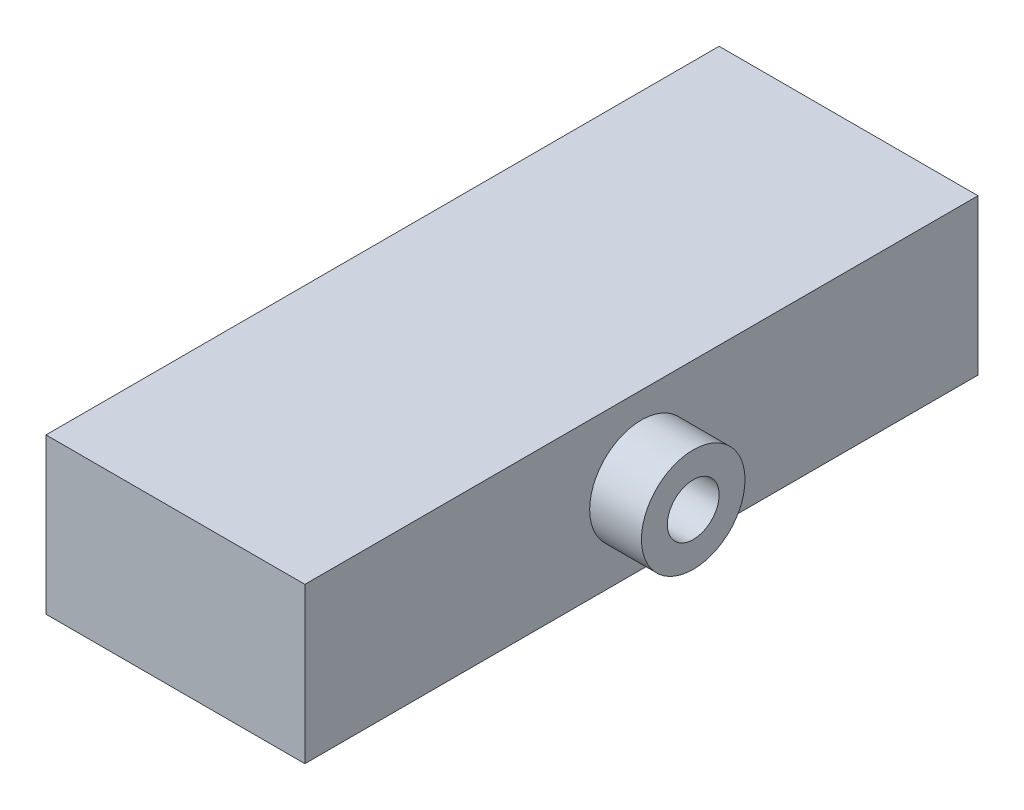
from build123d import *

# Parameters (mm, degrees)
SKETCH1_W           = 2.5
SKETCH1_H           = 6.5
BOSS_EXTRUDE1_DEPTH = 1.5
SKETCH2_R           = 0.5
SKETCH2_R_2         = 0.25
BOSS_EXTRUDE2_DEPTH = 0.5
SKETCH4_R           = 0.25
CUT_EXTRUDE1_DEPTH  = 0.5


with BuildPart() as part:
    # Sketch1 → Boss-Extrude1 (new body)
    with BuildSketch(Plane(origin=(0, 0, 0), x_dir=(1, 0, 0), z_dir=(0, 1, 0))):
        with Locations((1.25, 3.25)):
            Rectangle(SKETCH1_W, SKETCH1_H)
    extrude(amount=BOSS_EXTRUDE1_DEPTH)

    # Sketch2 → Boss-Extrude2 (add)
    with BuildSketch(Plane(origin=(2.5, 0, 0), x_dir=(0, 0, -1), z_dir=(1, 0, 0))):
        with Locations(Location((3.25, 0.75, 0), (0, 0, 180))):
            Circle(SKETCH2_R)
        with Locations((3.25, 0.75)):
            Circle(SKETCH2_R_2, mode=Mode.SUBTRACT)
    extrude(amount=BOSS_EXTRUDE2_DEPTH)

    # Sketch4 → Cut-Extrude1 (cut)
    with BuildSketch(Plane.ZY):
        with Locations((-5.75, 0.75)):
            Circle(SKETCH4_R)
        with Locations((-0.75, 0.75)):
            Circle(SKETCH4_R)
    extrude(amount=-CUT_EXTRUDE1_DEPTH, mode=Mode.SUBTRACT)


solid = part.part
